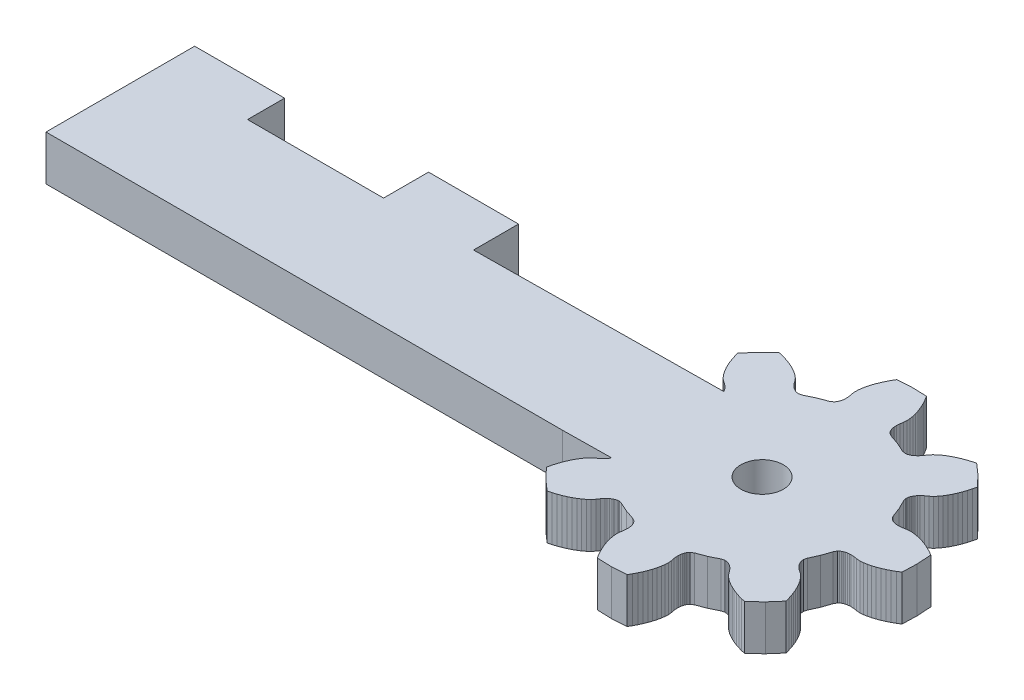
from build123d import *

# Parameters (mm, degrees)
SKETCH1_R           = 1.500100003
BOSS_EXTRUDE1_DEPTH = 3.175


with BuildPart() as part:
    # Sketch1 → Boss-Extrude1 (new body)
    with BuildSketch(Plane(origin=(0, 0, 0), x_dir=(1, 0, 0), z_dir=(0, 1, 0))):
        Polygon((63.490660584, 166.135437226), (63.490660584, 169.310437226), (57.140660584, 169.310437226), (57.140660584, 166.135437226), (47.540660584, 166.135437226), (47.540660584, 168.752887226), (41.190660584, 168.752887226), (41.190660584, 158.261337226), (77.647660584, 158.261337226), (81.024260584, 158.305437226), (81.057760584, 158.271437226), (80.991260584, 158.164237226), (80.917560584, 158.068737226), (80.838160584, 157.982137226), (80.665660584, 157.829737226), (80.478460584, 157.699537226), (80.305460584, 157.548237226), (80.152060584, 157.368237226), (80.011560584, 157.170537226), (79.882660584, 156.957837226), (79.764560584, 156.732137226), (79.657060584, 156.494337226), (79.560160584, 156.245637226), (79.473860584, 155.986537226), (79.398260584, 155.717737226), (79.333560584, 155.439937226), (80.040460584, 154.686037226), (80.816160584, 154.003137226), (81.091860584, 154.076537226), (81.358160584, 154.160537226), (81.614360584, 154.254937226), (81.859960584, 154.359637226), (82.094260584, 154.474537226), (82.316160584, 154.599637226), (82.524660584, 154.735237226), (82.717960584, 154.881737226), (82.892960584, 155.040737226), (83.038760584, 155.218437226), (83.162960584, 155.409637226), (83.309860584, 155.586837226), (83.393960584, 155.668937226), (83.487160584, 155.745637226), (83.592160584, 155.815337226), (83.650660584, 155.846937226), (83.714560584, 155.875537226), (83.785660584, 155.900137226), (83.867860584, 155.918937226), (83.970460584, 155.926937226), (84.191860584, 155.874037226), (84.834860584, 155.583037226), (85.502760584, 155.354937226), (85.700460584, 155.242037226), (85.769760584, 155.165837226), (85.816760584, 155.095937226), (85.851760584, 155.029337226), (85.878760584, 154.964737226), (85.899860584, 154.901737226), (85.928660584, 154.778937226), (85.944060584, 154.659237226), (85.949160584, 154.541837226), (85.934960584, 154.312137226), (85.894660584, 154.087737226), (85.879260584, 153.858437226), (85.898060584, 153.622637226), (85.938560584, 153.383537226), (85.997760584, 153.141937226), (86.073860584, 152.898837226), (86.165960584, 152.654737226), (86.273360584, 152.410337226), (86.395560584, 152.166037226), (86.532160584, 151.922637226), (86.682860584, 151.680437226), (87.715860584, 151.647137226), (88.747160584, 151.712837226), (88.890260584, 151.959637226), (89.019060584, 152.207237226), (89.133560584, 152.455237226), (89.233160584, 152.702937226), (89.317560584, 152.949737226), (89.386060584, 153.195237226), (89.437660584, 153.438537226), (89.470660584, 153.678837226), (89.481960584, 153.914937226), (89.459360584, 154.143737226), (89.412060584, 154.366737226), (89.390660584, 154.595937226), (89.392060584, 154.713437226), (89.403760584, 154.833537226), (89.428660584, 154.957137226), (89.447760584, 155.020837226), (89.472660584, 155.086237226), (89.505560584, 155.153937226), (89.550360584, 155.225237226), (89.617260584, 155.303537226), (89.811260584, 155.422637226), (90.471660584, 155.671637226), (91.105160584, 155.982637226), (91.324860584, 156.042437226), (91.427760584, 156.037637226), (91.510460584, 156.021537226), (91.582360584, 155.999137226), (91.647060584, 155.972537226), (91.706460584, 155.942837226), (91.813660584, 155.876337226), (91.909160584, 155.802637226), (91.995860584, 155.723237226), (92.148160584, 155.550837226), (92.278460584, 155.363637226), (92.429660584, 155.190537226), (92.609660584, 155.037137226), (92.807360584, 154.896737226), (93.020060584, 154.767737226), (93.245760584, 154.649637226), (93.483560584, 154.542237226), (93.732360584, 154.445337226), (93.991360584, 154.359037226), (94.260160584, 154.283437226), (94.538060584, 154.218737226), (95.291960584, 154.925537226), (95.974760584, 155.701337226), (95.901360584, 155.976937226), (95.817360584, 156.243237226), (95.722960584, 156.499537226), (95.618360584, 156.745137226), (95.503460584, 156.979337226), (95.378260584, 157.201337226), (95.242660584, 157.409737226), (95.096160584, 157.603037226), (94.937160584, 157.778037226), (94.759460584, 157.923837226), (94.568260584, 158.048137226), (94.391160584, 158.195037226), (94.309060584, 158.279137226), (94.232360584, 158.372237226), (94.162560584, 158.477337226), (94.130960584, 158.535837226), (94.102460584, 158.599637226), (94.077760584, 158.670837226), (94.059060584, 158.752937226), (94.050960584, 158.855637226), (94.103860584, 159.077037226), (94.394860584, 159.720037226), (94.622960584, 160.387937226), (94.735960584, 160.585537226), (94.812060584, 160.654937226), (94.881960584, 160.701937226), (94.948660584, 160.736937226), (95.013160584, 160.763937226), (95.076160584, 160.784937226), (95.198960584, 160.813737226), (95.318660584, 160.829137226), (95.436060584, 160.834237226), (95.665760584, 160.820137226), (95.890260584, 160.779837226), (96.119560584, 160.764437226), (96.355260584, 160.783137226), (96.594360584, 160.823737226), (96.835960584, 160.882937226), (97.079060584, 160.959037226), (97.323160584, 161.051137226), (97.567660584, 161.158537226), (97.811860584, 161.280637226), (98.055360584, 161.417337226), (98.297560584, 161.568037226), (98.330760584, 162.600937226), (98.265160584, 163.632337226), (98.018260584, 163.775337226), (97.770660584, 163.904237226), (97.522660584, 164.018637226), (97.274960584, 164.118337226), (97.028160584, 164.202737226), (96.782760584, 164.271237226), (96.539460584, 164.322737226), (96.299160584, 164.355737226), (96.062960584, 164.367137226), (95.834160584, 164.344537226), (95.611160584, 164.297237226), (95.381960584, 164.275837226), (95.264460584, 164.277237226), (95.144360584, 164.288837226), (95.020760584, 164.313837226), (94.957060584, 164.332837226), (94.891760584, 164.357837226), (94.823960584, 164.390637226), (94.752660584, 164.435437226), (94.674360584, 164.502437226), (94.555260584, 164.696437226), (94.306360584, 165.356837226), (93.995360584, 165.990337226), (93.935460584, 166.210037226), (93.940260584, 166.312837226), (93.956460584, 166.395537226), (93.978760584, 166.467437226), (94.005360584, 166.532137226), (94.035060584, 166.591537226), (94.101560584, 166.698837226), (94.175260584, 166.794337226), (94.254660584, 166.880937226), (94.427060584, 167.033337226), (94.614360584, 167.163537226), (94.787360584, 167.314837226), (94.940760584, 167.494737226), (95.081160584, 167.692537226), (95.210160584, 167.905137226), (95.328260584, 168.130937226), (95.435660584, 168.368637226), (95.532660584, 168.617437226), (95.618860584, 168.876537226), (95.694460584, 169.145337226), (95.759160584, 169.423137226), (95.052360584, 170.177037226), (94.276560584, 170.859837226), (94.000960584, 170.786437226), (93.734660584, 170.702537226), (93.478360584, 170.608137226), (93.232760584, 170.503437226), (92.998560584, 170.388537226), (92.776660584, 170.263437226), (92.568160584, 170.127837226), (92.374860584, 169.981237226), (92.199860584, 169.822337226), (92.054060584, 169.644537226), (91.929760584, 169.453337226), (91.782860584, 169.276237226), (91.698860584, 169.194137226), (91.605660584, 169.117437226), (91.500560584, 169.047637226), (91.442160584, 169.016137226), (91.378260584, 168.987537226), (91.307160584, 168.962937226), (91.224960584, 168.944137226), (91.122260584, 168.936137226), (90.900860584, 168.989037226), (90.257860584, 169.280037226), (89.589960584, 169.508037226), (89.392360584, 169.621037226), (89.323060584, 169.697137226), (89.275960584, 169.767137226), (89.240960584, 169.833737226), (89.213960584, 169.898237226), (89.192960584, 169.961337226), (89.164160584, 170.084137226), (89.148760584, 170.203837226), (89.143660584, 170.321237226), (89.157860584, 170.550837226), (89.198060584, 170.775337226), (89.213560584, 171.004637226), (89.194760584, 171.240337226), (89.154260584, 171.479537226), (89.095060584, 171.721037226), (89.018860584, 171.964237226), (88.926760584, 172.208237226), (88.819460584, 172.452737226), (88.697260584, 172.696937226), (88.560660584, 172.940437226), (88.409860584, 173.182637226), (87.376960584, 173.215937226), (86.345660584, 173.150237226), (86.202560584, 172.903437226), (86.073660584, 172.655737226), (85.959260584, 172.407837226), (85.859560584, 172.160137226), (85.775160584, 171.913237226), (85.706760584, 171.667837226), (85.655160584, 171.424537226), (85.622160584, 171.184237226), (85.610860584, 170.948037226), (85.633360584, 170.719337226), (85.680760584, 170.496237226), (85.702160584, 170.267137226), (85.700660584, 170.149637226), (85.689060584, 170.029537226), (85.664060584, 169.905837226), (85.645060584, 169.842237226), (85.620160584, 169.776837226), (85.587260584, 169.709137226), (85.542460584, 169.637837226), (85.475560584, 169.559537226), (85.281460584, 169.440337226), (84.621160584, 169.191437226), (83.987560584, 168.880437226), (83.767960584, 168.820537226), (83.665060584, 168.825337226), (83.582360584, 168.841537226), (83.510460584, 168.863937226), (83.445760584, 168.890537226), (83.386360584, 168.920137226), (83.279160584, 168.986637226), (83.183560584, 169.060337226), (83.096960584, 169.139837226), (82.944560584, 169.312237226), (82.814360584, 169.499437226), (82.663060584, 169.672437226), (82.483160584, 169.825937226), (82.285360584, 169.966337226), (82.072760584, 170.095237226), (81.846960584, 170.213337226), (81.609260584, 170.320837226), (81.360460584, 170.417737226), (81.101360584, 170.504037226), (80.832660584, 170.579637226), (80.554760584, 170.644337226), (79.800860584, 169.937437226), (79.118060584, 169.161737226), (79.191460584, 168.886037226), (79.275360584, 168.619737226), (79.369860584, 168.363537226), (79.474460584, 168.117937226), (79.589360584, 167.883737226), (79.714460584, 167.661737226), (79.850060584, 167.453237226), (79.996660584, 167.259937226), (80.155660584, 167.084937226), (80.333360584, 166.939237226), (80.524560584, 166.814937226), (80.701660584, 166.668037226), (80.783760584, 166.583937226), (80.860460584, 166.490737226), (80.930260584, 166.385737226), (80.961760584, 166.327237226), (80.976260584, 166.317737226), align=None)
        with Locations(Location((87.546260584, 162.444137226, 0), (0, 0, 270))):
            Circle(SKETCH1_R, mode=Mode.SUBTRACT)
    extrude(amount=BOSS_EXTRUDE1_DEPTH)


solid = part.part
